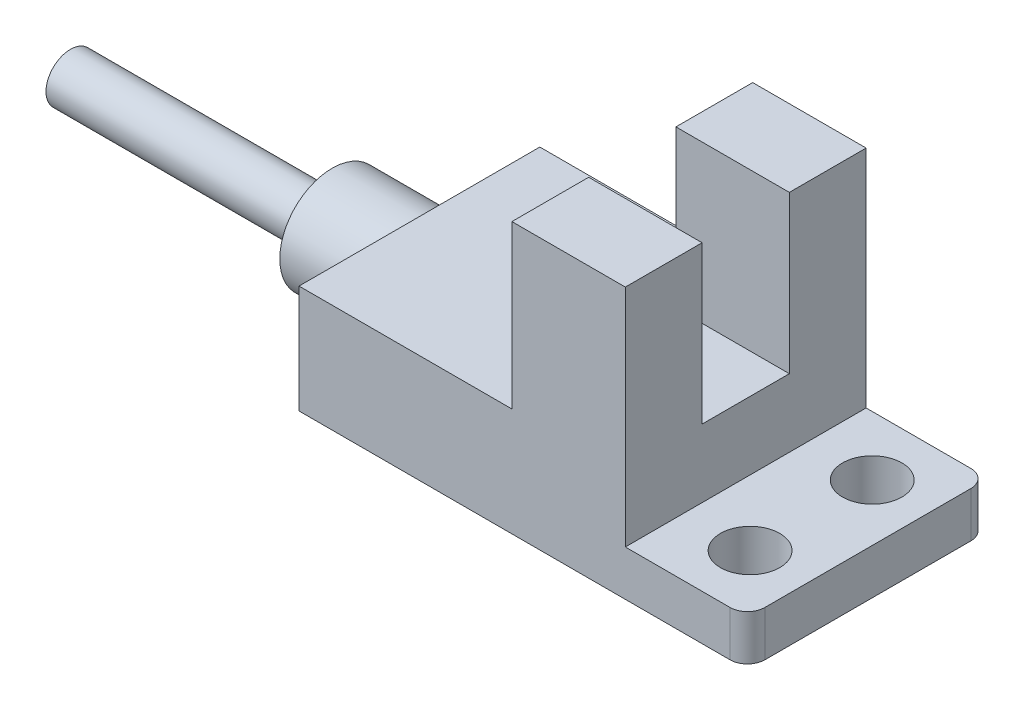
from build123d import *

# Parameters (mm, degrees)
BOSS_EXTRU_1_DEPTH           = 6.9
ENL_V_MAT_EXTRU_1_DEPTH      = 23.946949688
ENL_V_MAT_EXTRU_1_DEPTH_BACK = 23.946949688
ESQUISSE2_W                  = 5
ESQUISSE2_H                  = 9
D_GAGEMENT_M31_D             = 3.4
ESQUISSE5_R                  = 3
BOSS_EXTRU_2_DEPTH           = 5
ESQUISSE6_R                  = 1.4
BOSS_EXTRU_3_DEPTH           = 15
CONG_1_R                     = 1


with BuildPart() as part:
    # Esquisse1 → Boss.-Extru.1 (new, symmetric)
    with BuildSketch(Plane.XY):
        Polygon((-15.45, 0), (10.25, 0), (10.25, 2.6), (3.25, 2.6), (3.25, 15.5), (-3.25, 15.5), (-3.25, 6.2), (-15.45, 6.2), align=None)
    extrude(amount=BOSS_EXTRU_1_DEPTH, both=True)

    # Esquisse2 → Enlèv. mat.-Extru.1 (cut, two sides: drawn at the far end of the back side and taken through both)
    with BuildSketch(Plane(origin=(0, 0, 0), x_dir=(0, 0, -1), z_dir=(1, 0, 0)).offset(-ENL_V_MAT_EXTRU_1_DEPTH_BACK)):
        with Locations((0, 11)):
            Rectangle(ESQUISSE2_W, ESQUISSE2_H)
    extrude(amount=ENL_V_MAT_EXTRU_1_DEPTH + ENL_V_MAT_EXTRU_1_DEPTH_BACK, mode=Mode.SUBTRACT)

    # Dégagement M31 (through all)
    with Locations(Plane(origin=(0, 2.6, 0), x_dir=(1, 0, 0), z_dir=(0, 1, 0))):
        with Locations((7, 3.5), (7, -3.5)):
            Hole(D_GAGEMENT_M31_D / 2)

    # Esquisse5 → Boss.-Extru.2 (add)
    with BuildSketch(Plane.ZY.offset(15.45)):
        with Locations((0, 3.1)):
            Circle(ESQUISSE5_R)
    extrude(amount=BOSS_EXTRU_2_DEPTH)

    # Esquisse6 → Boss.-Extru.3 (add)
    with BuildSketch(Plane.ZY.offset(20.45)):
        with Locations((0, 3.1)):
            Circle(ESQUISSE6_R)
    extrude(amount=BOSS_EXTRU_3_DEPTH)

    # Congé1
    cong_1_edges = [part.edges().sort_by_distance(p)[0] for p in [
        (10.25, 1.3, -6.9),
        (10.25, 1.3, 6.9),
    ]]
    fillet(cong_1_edges, radius=CONG_1_R)


solid = part.part
